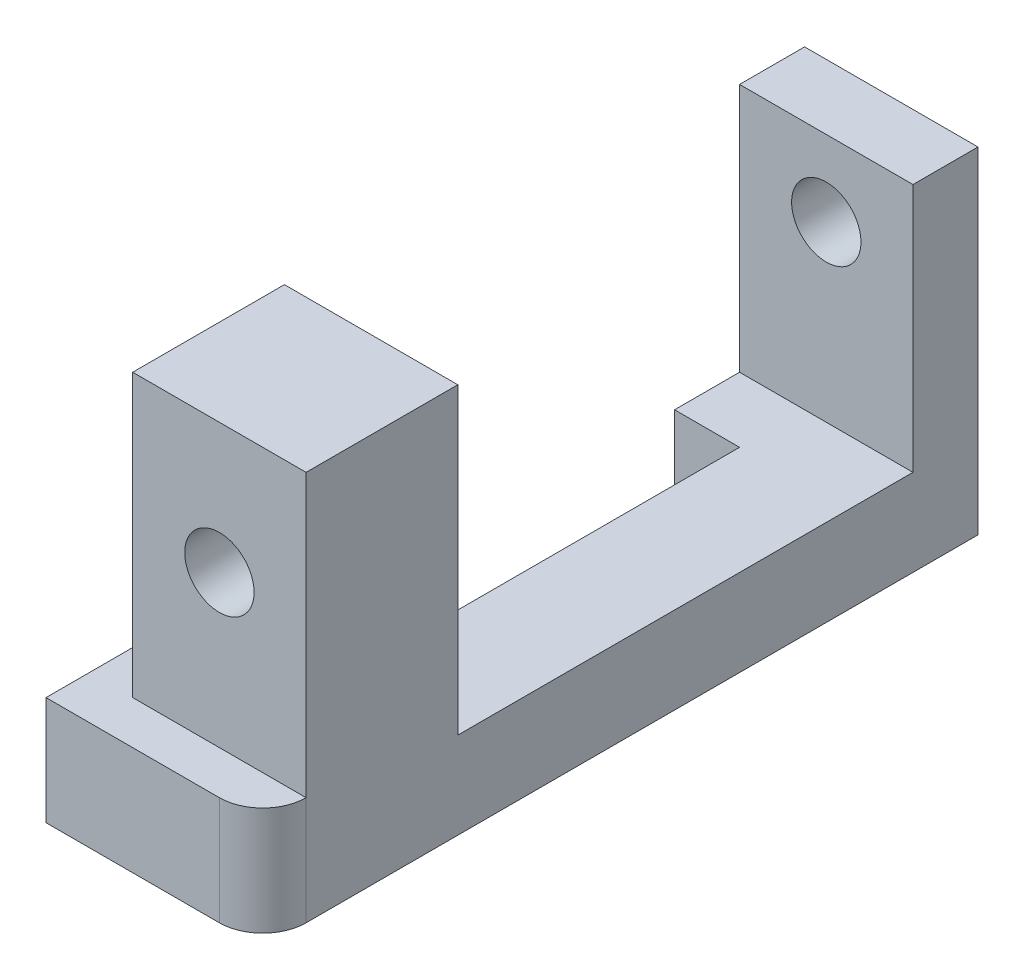
from build123d import *

# Parameters (mm, degrees)
BOSS_EXTRUDE1_DEPTH = 8
CUT_EXTRUDE2_DEPTH  = 21
BOSS_EXTRUDE2_DEPTH = 3
BOSS_EXTRUDE5_DEPTH = 5
SKETCH6_R           = 1.6
CUT_EXTRUDE3_DEPTH  = 38.215588132
SKETCH12_W          = 8
SKETCH12_H          = 3
CUT_EXTRUDE4_DEPTH  = 0.5


with BuildPart() as part:
    # Sketch1 → Boss-Extrude1 (new body)
    with BuildSketch(Plane(origin=(0, 0, 0), x_dir=(0, 0, -1), z_dir=(1, 0, 0))):
        Polygon((0, 0), (0, 16), (-3, 16), (-3, 4), (-24, 4), (-24, 18), (-31, 18), (-31, 0), align=None)
    extrude(amount=-BOSS_EXTRUDE1_DEPTH)

    # Sketch5 → Cut-Extrude2 (cut)
    with BuildSketch(Plane.XY.offset(3)):
        Polygon((-8, 0), (-3, 0), (-5, 4), (-8, 4), align=None)
    extrude(amount=CUT_EXTRUDE2_DEPTH, mode=Mode.SUBTRACT)

    # Sketch8 → Boss-Extrude2 (add)
    with BuildSketch(Plane.XY.offset(3)):
        Polygon((-8, 4), (-5, 4), (-3, 0), (-8, 0), align=None)
    extrude(amount=BOSS_EXTRUDE2_DEPTH)

    # Sketch11 → Boss-Extrude5 (add)
    with BuildSketch(Plane.XZ):
        with BuildLine():
            Line((-10, 26), (-10, 33))
            Line((-10, 33), (-2, 33))
            ThreePointArc((-2, 33), (-0.585786438, 32.414213562), (0, 31))
            Line((0, 31), (-8, 31))
            Line((-8, 31), (-8, 24))
            ThreePointArc((-8, 24), (-9.414213562, 24.585786438), (-10, 26))
        make_face()
    extrude(amount=-BOSS_EXTRUDE5_DEPTH)

    # Sketch6 → Cut-Extrude3 (cut, through all)
    with BuildSketch(Plane.XY.offset(31)):
        with Locations((-4, 12)):
            Circle(SKETCH6_R)
    extrude(amount=-CUT_EXTRUDE3_DEPTH, mode=Mode.SUBTRACT)

    # Sketch12 → Cut-Extrude4 (cut)
    with BuildSketch(Plane(origin=(0, 16, 0), x_dir=(1, 0, 0), z_dir=(0, 1, 0))):
        with Locations((-4, -1.5)):
            Rectangle(SKETCH12_W, SKETCH12_H)
    extrude(amount=-CUT_EXTRUDE4_DEPTH, mode=Mode.SUBTRACT)


solid = part.part
